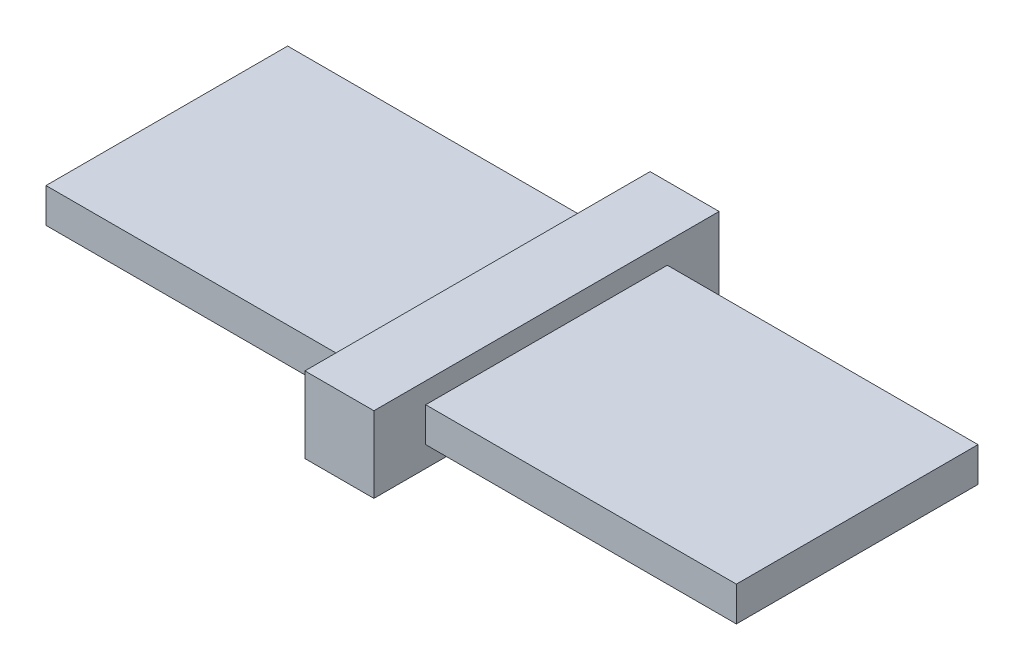
from build123d import *

# Parameters (mm, degrees)
SKETCH_1_W      = 100
SKETCH_1_H      = 35
EXTRUDE_1_DEPTH = 5
SKETCH_3_W      = 50
SKETCH_3_H      = 11
EXTRUDE_2_DEPTH = 5


with BuildPart() as part:
    # 草图1 → 凸台-拉伸1 (new body)
    with BuildSketch(Plane(origin=(0, 0, 0), x_dir=(1, 0, 0), z_dir=(0, 1, 0))):
        Rectangle(SKETCH_1_W, SKETCH_1_H)
    extrude(amount=EXTRUDE_1_DEPTH)

    # 草图3 → 凸台-拉伸2 (add, symmetric)
    with BuildSketch(Plane(origin=(0, 0, 0), x_dir=(0, 0, -1), z_dir=(1, 0, 0))):
        with Locations((0, 2.5)):
            Rectangle(SKETCH_3_W, SKETCH_3_H)
    extrude(amount=EXTRUDE_2_DEPTH, both=True)


solid = part.part
